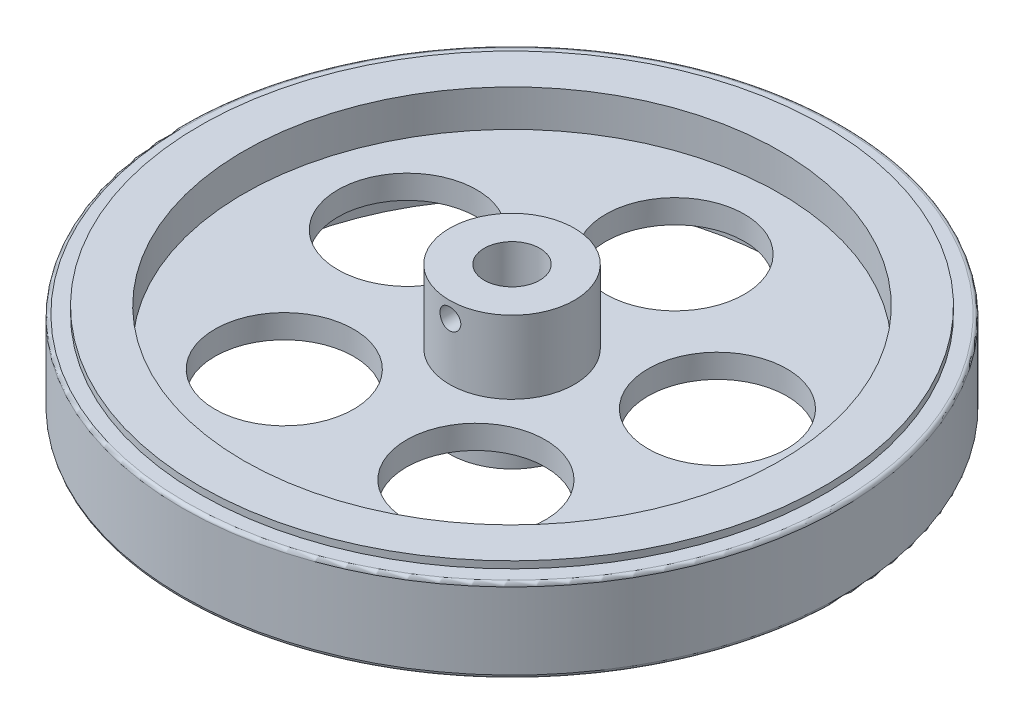
from build123d import *

# Parameters (mm, degrees)
SKETCH_1_R          = 47.5
SKETCH_1_R_2        = 9
SKETCH_1_R_3        = 4
EXTRUDE_1_DEPTH     = 7
SKETCH_2_R          = 47.5
SKETCH_2_R_2        = 45
CUT_EXTRUDE_1_DEPTH = 1
SKETCH_3_R          = 38.66
SKETCH_3_R_2        = 9
CUT_EXTRUDE_2_DEPTH = 5.3
SKETCH_4_R          = 10
CUT_EXTRUDE_3_DEPTH = 68.736179402
FILLET_1_R          = 0.5
SKETCH_5_R          = 9
SKETCH_5_R_2        = 4
EXTRUDE_2_DEPTH     = 5.2
SKETCH_6_R          = 1.5
CUT_EXTRUDE_4_DEPTH = 69.274006906


with BuildPart() as part:
    # 草圖1 → 填料-伸長1 (new, symmetric)
    # profile 1 of 2: a face of its own
    with BuildSketch(Plane(origin=(0, 0, 0), x_dir=(1, 0, 0), z_dir=(0, 1, 0))):
        with Locations(Location((0, 0, 0), (0, 0, 270))):
            Circle(SKETCH_1_R)
        Circle(SKETCH_1_R_2, mode=Mode.SUBTRACT)
    # profile 2 of 2: a face of its own
    with BuildSketch(Plane(origin=(0, 0, 0), x_dir=(1, 0, 0), z_dir=(0, 1, 0))):
        Circle(SKETCH_1_R_2)
        with Locations(Location((0, 0, 0), (0, 0, 270))):
            Circle(SKETCH_1_R_3, mode=Mode.SUBTRACT)
    extrude(amount=EXTRUDE_1_DEPTH, both=True)

    # 草圖2 → 除料-伸長1 (cut)
    with BuildSketch(Plane(origin=(0, 7, 0), x_dir=(1, 0, 0), z_dir=(0, 1, 0))):
        with Locations(Location((0, 0, 0), (0, 0, 270))):
            Circle(SKETCH_2_R)
        with Locations(Location((0, 0, 0), (0, 0, 270))):
            Circle(SKETCH_2_R_2, mode=Mode.SUBTRACT)
    cut_extrude_1 = extrude(amount=-CUT_EXTRUDE_1_DEPTH, mode=Mode.SUBTRACT)

    # 鏡射1: 除料-伸長1 across plane
    add(cut_extrude_1.mirror(Plane.ZX), mode=Mode.SUBTRACT)

    # 草圖3 → 除料-伸長2 (cut)
    with BuildSketch(Plane(origin=(0, 7, 0), x_dir=(1, 0, 0), z_dir=(0, 1, 0))):
        with Locations(Location((0, 0, 0), (0, 0, 270))):
            Circle(SKETCH_3_R)
        with Locations(Location((0, 0, 0), (0, 0, 270))):
            Circle(SKETCH_3_R_2, mode=Mode.SUBTRACT)
    cut_extrude_2 = extrude(amount=-CUT_EXTRUDE_2_DEPTH, mode=Mode.SUBTRACT)

    # 鏡射2: 除料-伸長2 across plane
    add(cut_extrude_2.mirror(Plane.ZX), mode=Mode.SUBTRACT)

    # 草圖4 → 除料-伸長3 (cut, through all)
    with BuildSketch(Plane(origin=(0, 1.7, 0), x_dir=(1, 0, 0), z_dir=(0, 1, 0))):
        with Locations(Location((0, 23.5, 0), (0, 0, 270))):
            Circle(SKETCH_4_R)
        with Locations(Location((22.349828133, 7.261899368, 0), (0, 0, 270))):
            Circle(SKETCH_4_R)
        with Locations(Location((13.812953429, -19.011899368, 0), (0, 0, 270))):
            Circle(SKETCH_4_R)
        with Locations(Location((-13.812953429, -19.011899368, 0), (0, 0, 270))):
            Circle(SKETCH_4_R)
        with Locations(Location((-22.349828133, 7.261899368, 0), (0, 0, 270))):
            Circle(SKETCH_4_R)
    extrude(amount=-CUT_EXTRUDE_3_DEPTH, mode=Mode.SUBTRACT)

    # 圓角1
    fillet_1_edges = [part.edges().sort_by_distance(p)[0] for p in [
        (0, 6, -47.5),
        (0, -6, -47.5),
    ]]
    fillet(fillet_1_edges, radius=FILLET_1_R)

    # 草圖5 → 填料-伸長2 (add)
    with BuildSketch(Plane(origin=(0, 7, 0), x_dir=(1, 0, 0), z_dir=(0, 1, 0))):
        with Locations(Location((0, 0, 0), (0, 0, 270))):
            Circle(SKETCH_5_R)
        with Locations(Location((0, 0, 0), (0, 0, 270))):
            Circle(SKETCH_5_R_2, mode=Mode.SUBTRACT)
    extrude(amount=EXTRUDE_2_DEPTH)

    # 草圖6 → 除料-伸長4 (cut, through all)
    with BuildSketch(Plane.XY):
        with Locations(Location((0, 9.9, 0), (0, 0, 270.000000003))):
            Circle(SKETCH_6_R)
    extrude(amount=CUT_EXTRUDE_4_DEPTH, mode=Mode.SUBTRACT)


solid = part.part
